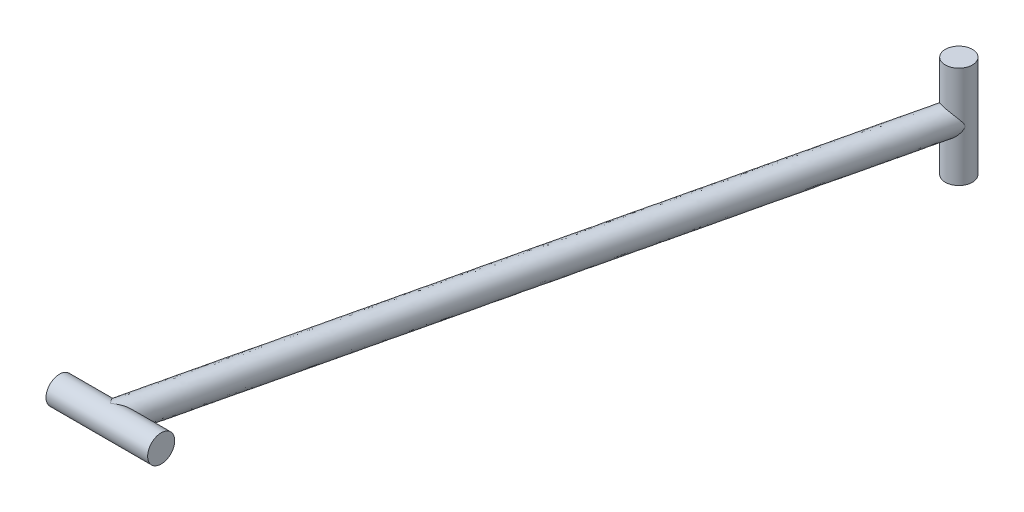
from build123d import *

# Parameters (mm, degrees)
SKETCH2_R = 2
SKETCH6_R = 2
SKETCH7_R = 2


with BuildPart() as part:
    # Sweep1: sweep along a path in Sketch3
    with BuildLine(Plane(origin=(0, 0, 0), x_dir=(1, 0, 0), z_dir=(0, 1, 0))) as sweep1_path:
        Line((0, 0), (23.851236343, 101.371880346))
    # Sketch2 → Sweep1 (sweep)
    with BuildSketch(Plane.XY):
        Circle(SKETCH2_R)
    sweep(path=sweep1_path.line)

    # Sweep2: sweep along a path in Sketch5
    with BuildLine(Plane(origin=(0, 0, -101.371880346), x_dir=(-1, 0, 0), z_dir=(0, 0, -1))) as sweep2_path:
        Line((-23.851236343, -7.5), (-23.851236343, 7.5))
    # Sketch6 → Sweep2 (sweep)
    with BuildSketch(Plane(origin=(23.851236343, 7.5, -101.371880346), x_dir=(1, 0, 0), z_dir=(0, 1, 0))):
        Circle(SKETCH6_R)
    sweep(path=sweep2_path.line)

    # Sweep3: sweep along a path in Sketch4
    with BuildLine(Plane.XY) as sweep3_path:
        Line((-7.5, 0), (7.5, 0))
    # Sketch7 → Sweep3 (sweep)
    with BuildSketch(Plane(origin=(7.5, 0, 0), x_dir=(0, 0, -1), z_dir=(1, 0, 0))):
        Circle(SKETCH7_R)
    sweep(path=sweep3_path.line)


solid = part.part
